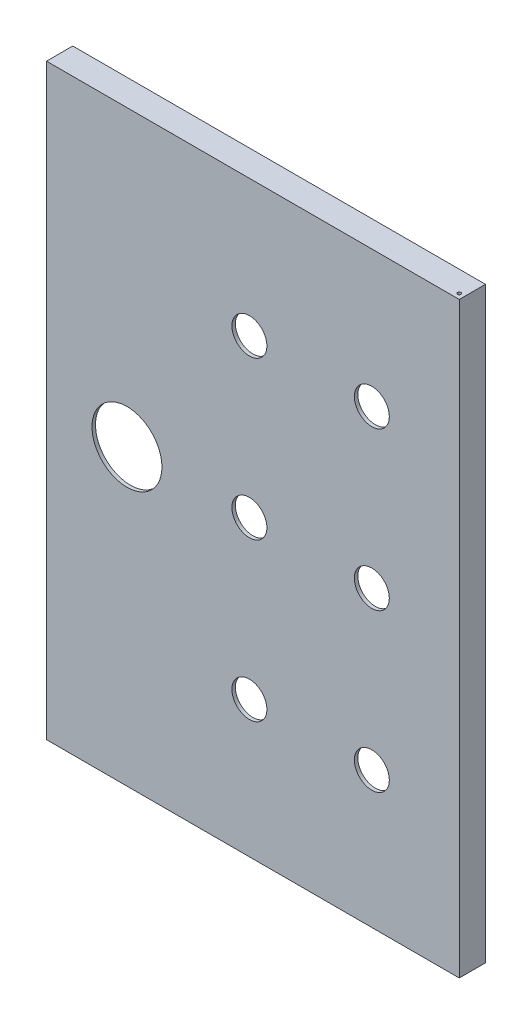
from build123d import *

# Parameters (mm, degrees)
SKETCH_1_W               = 236
SKETCH_1_H               = 336
EXTRUDE_1_DEPTH          = 15
SHELL_2_T                = -2
SKETCH_2_W               = 232
SKETCH_2_H               = 332
SKETCH_2_W_2             = 216
SKETCH_2_H_2             = 316
EXTRUDE_2_DEPTH          = 2
CUT_EXTRUDE_1_DEPTH      = 357.433724555
CUT_EXTRUDE_1_DEPTH_BACK = 357.433724555
SKETCH_3_R               = 1
SKETCH_4_R               = 20
SKETCH_4_R_2             = 10
CUT_EXTRUDE_2_DEPTH      = 2


with BuildPart() as part:
    # 草图1 → 凸台-拉伸1 (new body)
    with BuildSketch(Plane.XY):
        Rectangle(SKETCH_1_W, SKETCH_1_H)
    extrude(amount=EXTRUDE_1_DEPTH)

    # 抽壳2
    shell_2_openings = [part.faces().sort_by_distance(p)[0] for p in [
        (0, 0, 0),
    ]]
    offset(amount=SHELL_2_T, openings=shell_2_openings, kind=Kind.INTERSECTION)

    # 草图2 → 凸台-拉伸2 (add)
    with BuildSketch(Plane.XY):
        Rectangle(SKETCH_2_W, SKETCH_2_H)
        Rectangle(SKETCH_2_W_2, SKETCH_2_H_2, mode=Mode.SUBTRACT)
    extrude(amount=EXTRUDE_2_DEPTH)

    # 草图3 → 切除-拉伸1 (cut, two sides: drawn at the far end of the back side and taken through both)
    with BuildSketch(Plane(origin=(0, 168, 0), x_dir=(1, 0, 0), z_dir=(0, 1, 0)).offset(-CUT_EXTRUDE_1_DEPTH_BACK)):
        with Locations(Location((115, -12, 0), (0, 0, 270))):
            Circle(SKETCH_3_R)
    extrude(amount=CUT_EXTRUDE_1_DEPTH + CUT_EXTRUDE_1_DEPTH_BACK, mode=Mode.SUBTRACT)

    # 草图4 → 切除-拉伸2 (cut)
    with BuildSketch(Plane.XY.offset(15)):
        with Locations((-72, 0)):
            Circle(SKETCH_4_R)
        with Locations((-2, 0)):
            Circle(SKETCH_4_R_2)
        with Locations((68, 0)):
            Circle(SKETCH_4_R_2)
        with Locations((68, 90)):
            Circle(SKETCH_4_R_2)
        with Locations((-2, 90)):
            Circle(SKETCH_4_R_2)
        with Locations((68, -90)):
            Circle(SKETCH_4_R_2)
        with Locations((-2, -90)):
            Circle(SKETCH_4_R_2)
    extrude(amount=-CUT_EXTRUDE_2_DEPTH, mode=Mode.SUBTRACT)


solid = part.part
